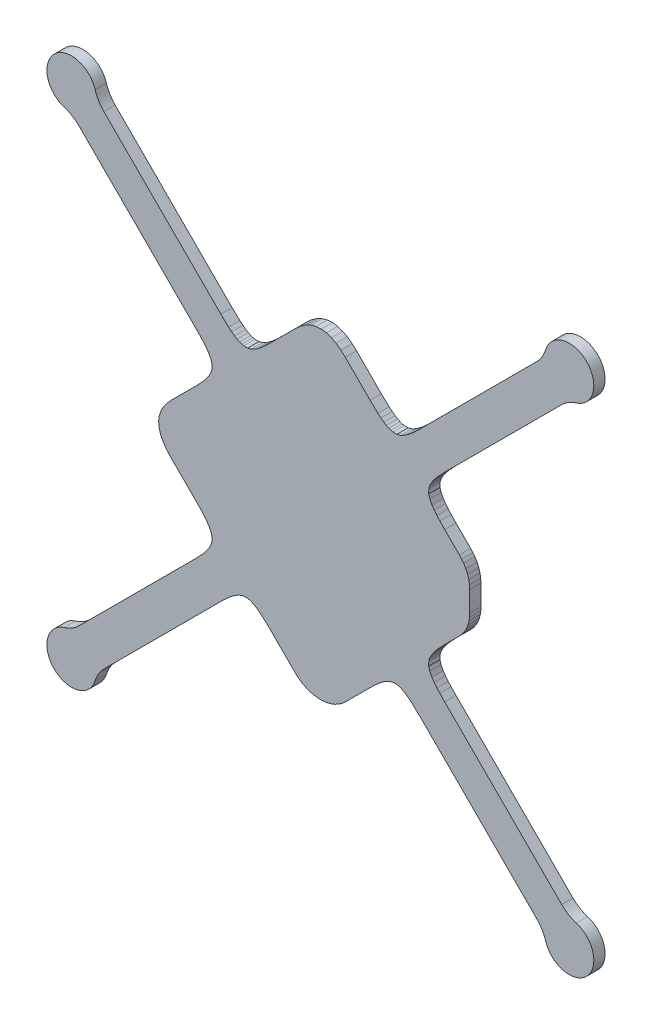
from build123d import *

# Parameters (mm, degrees)
BOSS_EXTRUDE1_DEPTH = 1.6


with BuildPart() as part:
    # Sketch1 → Boss-Extrude1 (new body)
    with BuildSketch(Plane.XY):
        with BuildLine():
            Line((-34.539948317, 35.142224491), (-35.587948317, 34.029724491))
            Line((-35.587948317, 34.029724491), (-39.122948317, 30.494224491))
            Line((-39.122948317, 30.494224491), (-39.697948317, 29.863224491))
            Line((-39.697948317, 29.863224491), (-40.188948317, 29.186224491))
            Line((-40.188948317, 29.186224491), (-40.547948317, 28.514224491))
            Line((-40.547948317, 28.514224491), (-40.788948317, 27.809224491))
            Line((-40.788948317, 27.809224491), (-40.888948317, 27.081224491))
            Line((-40.888948317, 27.081224491), (-40.837948317, 26.349224491))
            Line((-40.837948317, 26.349224491), (-40.641948317, 25.633224491))
            Line((-40.641948317, 25.633224491), (-40.469948317, 25.233224491))
            Line((-40.469948317, 25.233224491), (-40.258948317, 24.844224491))
            Line((-40.258948317, 24.844224491), (-39.740948317, 24.106224491))
            Line((-39.740948317, 24.106224491), (-39.122948317, 23.423224491))
            Line((-39.122948317, 23.423224491), (-35.587948317, 19.887224491))
            Line((-35.587948317, 19.887224491), (-34.884948317, 19.160224491))
            Line((-34.884948317, 19.160224491), (-34.472948317, 18.697224491))
            Line((-34.472948317, 18.697224491), (-34.093948317, 18.229224491))
            Line((-34.093948317, 18.229224491), (-33.763948317, 17.754224491))
            Line((-33.763948317, 17.754224491), (-33.460948317, 17.173224491))
            Line((-33.460948317, 17.173224491), (-33.308948317, 16.623224491))
            Line((-33.308948317, 16.623224491), (-33.310948317, 16.068224491))
            Line((-33.310948317, 16.068224491), (-33.376948317, 15.768224491))
            Line((-33.376948317, 15.768224491), (-33.485948317, 15.470224491))
            Line((-33.485948317, 15.470224491), (-33.659948317, 15.123224491))
            Line((-33.659948317, 15.123224491), (-33.874948317, 14.780224491))
            Line((-33.874948317, 14.780224491), (-34.188948317, 14.352224491))
            Line((-34.188948317, 14.352224491), (-34.539948317, 13.929224491))
            Line((-34.539948317, 13.929224491), (-35.587948317, 12.816224491))
            Line((-35.587948317, 12.816224491), (-52.205024084, -3.800439968))
            ThreePointArc((-52.205024084, -3.800439968), (-53.166508347, -4.554355048), (-54.283983989, -5.048407802))
            ThreePointArc((-54.283983989, -5.048407802), (-55.739822052, -10.871649243), (-49.916580611, -9.415811181))
            ThreePointArc((-49.916580611, -9.415811181), (-49.422637782, -8.297807082), (-48.668612776, -7.335851275))
            Line((-48.668612776, -7.335851275), (-32.051948317, 9.281224491))
            Line((-32.051948317, 9.281224491), (-31.323948317, 9.983224491))
            Line((-31.323948317, 9.983224491), (-30.861948317, 10.395224491))
            Line((-30.861948317, 10.395224491), (-30.393948317, 10.774224491))
            Line((-30.393948317, 10.774224491), (-29.918948317, 11.104224491))
            Line((-29.918948317, 11.104224491), (-29.337948317, 11.407224491))
            Line((-29.337948317, 11.407224491), (-28.787948317, 11.560224491))
            Line((-28.787948317, 11.560224491), (-28.232948317, 11.558224491))
            Line((-28.232948317, 11.558224491), (-27.932948317, 11.491224491))
            Line((-27.932948317, 11.491224491), (-27.634948317, 11.382224491))
            Line((-27.634948317, 11.382224491), (-27.287948317, 11.208224491))
            Line((-27.287948317, 11.208224491), (-26.943948317, 10.994224491))
            Line((-26.943948317, 10.994224491), (-26.515948317, 10.679224491))
            Line((-26.515948317, 10.679224491), (-26.092948317, 10.328224491))
            Line((-26.092948317, 10.328224491), (-24.980948317, 9.281224491))
            Line((-24.980948317, 9.281224491), (-21.445482223, 5.745690585))
            ThreePointArc((-21.445482223, 5.745690585), (-17.909948317, 4.281224491), (-14.374414411, 5.745690585))
            Line((-14.374414411, 5.745690585), (-10.838948317, 9.281224491))
            Line((-10.838948317, 9.281224491), (-10.110948317, 9.983224491))
            Line((-10.110948317, 9.983224491), (-9.648948317, 10.395224491))
            Line((-9.648948317, 10.395224491), (-9.180948317, 10.774224491))
            Line((-9.180948317, 10.774224491), (-8.705948317, 11.104224491))
            Line((-8.705948317, 11.104224491), (-8.124948317, 11.407224491))
            Line((-8.124948317, 11.407224491), (-7.573948317, 11.560224491))
            Line((-7.573948317, 11.560224491), (-7.019948317, 11.558224491))
            Line((-7.019948317, 11.558224491), (-6.719948317, 11.491224491))
            Line((-6.719948317, 11.491224491), (-6.421948317, 11.382224491))
            Line((-6.421948317, 11.382224491), (-6.073948317, 11.208224491))
            Line((-6.073948317, 11.208224491), (-5.730948317, 10.994224491))
            Line((-5.730948317, 10.994224491), (-5.302948317, 10.679224491))
            Line((-5.302948317, 10.679224491), (-4.879948317, 10.328224491))
            Line((-4.879948317, 10.328224491), (-3.767948317, 9.281224491))
            Line((-3.767948317, 9.281224491), (12.848716141, -7.335851275))
            ThreePointArc((12.848716141, -7.335851275), (13.602741147, -8.297807082), (14.096683976, -9.415811181))
            ThreePointArc((14.096683976, -9.415811181), (19.919914618, -10.871660042), (18.464116574, -5.048416695))
            ThreePointArc((18.464116574, -5.048416695), (17.346624783, -4.554362958), (16.385127449, -3.800439968))
            Line((16.385127449, -3.800439968), (-0.231948317, 12.816224491))
            Line((-0.231948317, 12.816224491), (-0.934948317, 13.544224491))
            Line((-0.934948317, 13.544224491), (-1.346948317, 14.006224491))
            Line((-1.346948317, 14.006224491), (-1.725948317, 14.475224491))
            Line((-1.725948317, 14.475224491), (-2.055948317, 14.949224491))
            Line((-2.055948317, 14.949224491), (-2.358948317, 15.530224491))
            Line((-2.358948317, 15.530224491), (-2.510948317, 16.081224491))
            Line((-2.510948317, 16.081224491), (-2.508948317, 16.635224491))
            Line((-2.508948317, 16.635224491), (-2.441948317, 16.935224491))
            Line((-2.441948317, 16.935224491), (-2.332948317, 17.233224491))
            Line((-2.332948317, 17.233224491), (-2.158948317, 17.581224491))
            Line((-2.158948317, 17.581224491), (-1.944948317, 17.924224491))
            Line((-1.944948317, 17.924224491), (-1.630948317, 18.352224491))
            Line((-1.630948317, 18.352224491), (-1.279948317, 18.775224491))
            Line((-1.279948317, 18.775224491), (-0.231948317, 19.887224491))
            Line((-0.231948317, 19.887224491), (1.839051683, 21.958224491))
            Line((1.839051683, 21.958224491), (2.240051683, 22.405224491))
            Line((2.240051683, 22.405224491), (2.581051683, 22.885224491))
            Line((2.581051683, 22.885224491), (2.868051683, 23.416224491))
            Line((2.868051683, 23.416224491), (3.083051683, 23.978224491))
            Line((3.083051683, 23.978224491), (3.225051683, 24.568224491))
            Line((3.225051683, 24.568224491), (3.284051683, 25.025224491))
            Line((3.284051683, 25.025224491), (3.303051683, 25.494224491))
            Line((3.303051683, 25.494224491), (3.303051683, 28.423224491))
            Line((3.303051683, 28.423224491), (3.271051683, 29.023224491))
            Line((3.271051683, 29.023224491), (3.173051683, 29.603224491))
            Line((3.173051683, 29.603224491), (3.000051683, 30.181224491))
            Line((3.000051683, 30.181224491), (2.755051683, 30.731224491))
            Line((2.755051683, 30.731224491), (2.438051683, 31.248224491))
            Line((2.438051683, 31.248224491), (2.157051683, 31.613224491))
            Line((2.157051683, 31.613224491), (1.839051683, 31.958224491))
            Line((1.839051683, 31.958224491), (-0.231948317, 34.029724491))
            Line((-0.231948317, 34.029724491), (-0.934948317, 34.757524491))
            Line((-0.934948317, 34.757524491), (-1.346948317, 35.219724491))
            Line((-1.346948317, 35.219724491), (-1.725948317, 35.687924491))
            Line((-1.725948317, 35.687924491), (-2.055948317, 36.162624491))
            Line((-2.055948317, 36.162624491), (-2.358948317, 36.743824491))
            Line((-2.358948317, 36.743824491), (-2.510948317, 37.294124491))
            Line((-2.510948317, 37.294124491), (-2.508948317, 37.848624491))
            Line((-2.508948317, 37.848624491), (-2.441948317, 38.148724491))
            Line((-2.441948317, 38.148724491), (-2.332948317, 38.446824491))
            Line((-2.332948317, 38.446824491), (-2.158948317, 38.794024491))
            Line((-2.158948317, 38.794024491), (-1.944948317, 39.137224491))
            Line((-1.944948317, 39.137224491), (-1.630948317, 39.565424491))
            Line((-1.630948317, 39.565424491), (-1.279948317, 39.988224491))
            Line((-1.279948317, 39.988224491), (-0.231948317, 41.100724491))
            Line((-0.231948317, 41.100724491), (16.385127449, 57.717588949))
            ThreePointArc((16.385127449, 57.717588949), (17.346624783, 58.47151194), (18.464116574, 58.965565677))
            ThreePointArc((18.464116574, 58.965565677), (19.919914618, 64.788809024), (14.096683976, 63.332960163))
            ThreePointArc((14.096683976, 63.332960163), (13.602686177, 62.215220293), (12.848716141, 61.253500257))
            Line((12.848716141, 61.253500257), (-3.767948317, 44.636324491))
            Line((-3.767948317, 44.636324491), (-4.495948317, 43.933824491))
            Line((-4.495948317, 43.933824491), (-4.957948317, 43.521824491))
            Line((-4.957948317, 43.521824491), (-5.425948317, 43.142924491))
            Line((-5.425948317, 43.142924491), (-5.900948317, 42.812824491))
            Line((-5.900948317, 42.812824491), (-6.481948317, 42.509924491))
            Line((-6.481948317, 42.509924491), (-7.031948317, 42.357424491))
            Line((-7.031948317, 42.357424491), (-7.586948317, 42.359224491))
            Line((-7.586948317, 42.359224491), (-7.886948317, 42.426224491))
            Line((-7.886948317, 42.426224491), (-8.184948317, 42.535024491))
            Line((-8.184948317, 42.535024491), (-8.531948317, 42.709124491))
            Line((-8.531948317, 42.709124491), (-8.874948317, 42.923424491))
            Line((-8.874948317, 42.923424491), (-9.302948317, 43.238024491))
            Line((-9.302948317, 43.238024491), (-9.725948317, 43.588624491))
            Line((-9.725948317, 43.588624491), (-10.838948317, 44.636324491))
            Line((-10.838948317, 44.636324491), (-14.373948317, 48.171824491))
            Line((-14.373948317, 48.171824491), (-15.005948317, 48.746824491))
            Line((-15.005948317, 48.746824491), (-15.681948317, 49.237924491))
            Line((-15.681948317, 49.237924491), (-16.353948317, 49.597224491))
            Line((-16.353948317, 49.597224491), (-17.059948317, 49.837424491))
            Line((-17.059948317, 49.837424491), (-17.787948317, 49.937524491))
            Line((-17.787948317, 49.937524491), (-18.519948317, 49.887024491))
            Line((-18.519948317, 49.887024491), (-19.234948317, 49.691124491))
            Line((-19.234948317, 49.691124491), (-19.635948317, 49.518324491))
            Line((-19.635948317, 49.518324491), (-20.023948317, 49.307324491))
            Line((-20.023948317, 49.307324491), (-20.761948317, 48.789324491))
            Line((-20.761948317, 48.789324491), (-21.444948317, 48.171824491))
            Line((-21.444948317, 48.171824491), (-24.980948317, 44.636324491))
            Line((-24.980948317, 44.636324491), (-25.708948317, 43.933824491))
            Line((-25.708948317, 43.933824491), (-26.170948317, 43.521824491))
            Line((-26.170948317, 43.521824491), (-26.638948317, 43.142924491))
            Line((-26.638948317, 43.142924491), (-27.113948317, 42.812824491))
            Line((-27.113948317, 42.812824491), (-27.694948317, 42.509924491))
            Line((-27.694948317, 42.509924491), (-28.244948317, 42.357424491))
            Line((-28.244948317, 42.357424491), (-28.799948317, 42.359224491))
            Line((-28.799948317, 42.359224491), (-29.099948317, 42.426224491))
            Line((-29.099948317, 42.426224491), (-29.397948317, 42.535024491))
            Line((-29.397948317, 42.535024491), (-29.744948317, 42.709124491))
            Line((-29.744948317, 42.709124491), (-30.088948317, 42.923424491))
            Line((-30.088948317, 42.923424491), (-30.516948317, 43.238024491))
            Line((-30.516948317, 43.238024491), (-30.939948317, 43.588624491))
            Line((-30.939948317, 43.588624491), (-32.051948317, 44.636324491))
            Line((-32.051948317, 44.636324491), (-48.668612776, 61.253500257))
            ThreePointArc((-48.668612776, 61.253500257), (-49.422590724, 62.215233363), (-49.916589504, 63.332989383))
            ThreePointArc((-49.916589504, 63.332989383), (-55.73983285, 64.788787426), (-54.283983989, 58.965556784))
            ThreePointArc((-54.283983989, 58.965556784), (-53.166508347, 58.471504029), (-52.205024084, 57.717588949))
            Line((-52.205024084, 57.717588949), (-35.587948317, 41.100724491))
            Line((-35.587948317, 41.100724491), (-34.884948317, 40.372924491))
            Line((-34.884948317, 40.372924491), (-34.472948317, 39.910724491))
            Line((-34.472948317, 39.910724491), (-34.093948317, 39.442424491))
            Line((-34.093948317, 39.442424491), (-33.763948317, 38.967824491))
            Line((-33.763948317, 38.967824491), (-33.460948317, 38.386624491))
            Line((-33.460948317, 38.386624491), (-33.308948317, 37.836324491))
            Line((-33.308948317, 37.836324491), (-33.310948317, 37.281824491))
            Line((-33.310948317, 37.281824491), (-33.376948317, 36.981724491))
            Line((-33.376948317, 36.981724491), (-33.485948317, 36.683624491))
            Line((-33.485948317, 36.683624491), (-33.659948317, 36.336424491))
            Line((-33.659948317, 36.336424491), (-33.874948317, 35.993224491))
            Line((-33.874948317, 35.993224491), (-34.188948317, 35.565024491))
            Line((-34.188948317, 35.565024491), (-34.539948317, 35.142224491))
        make_face()
    extrude(amount=BOSS_EXTRUDE1_DEPTH)


solid = part.part
